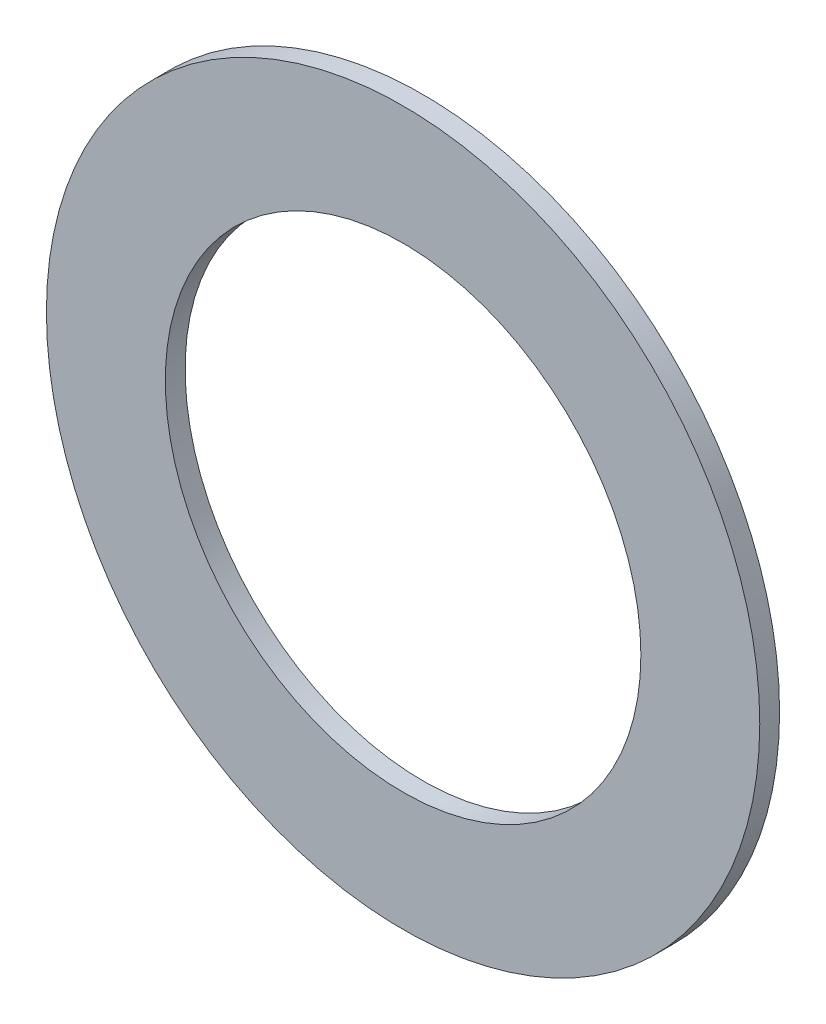
from build123d import *

# Parameters (mm, degrees)
SKETCH_1_R      = 9
SKETCH_1_R_2    = 6
EXTRUDE_1_DEPTH = 0.25


with BuildPart() as part:
    # 草图1 → 凸台-拉伸1 (new, symmetric)
    with BuildSketch(Plane.XY):
        Circle(SKETCH_1_R)
        Circle(SKETCH_1_R_2, mode=Mode.SUBTRACT)
    extrude(amount=EXTRUDE_1_DEPTH, both=True)


solid = part.part
